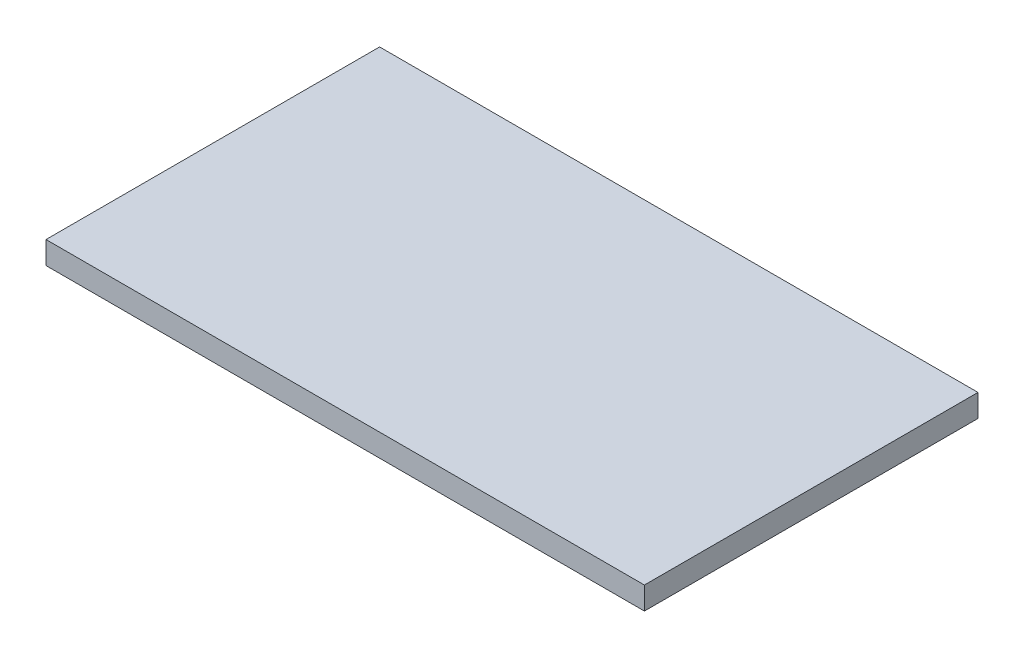
from build123d import *

# Parameters (mm, degrees)
SKETCH1_W           = 148.082
SKETCH1_H           = 82.55
BOSS_EXTRUDE1_DEPTH = 5.588


with BuildPart() as part:
    # Sketch1 → Boss-Extrude1 (new body)
    with BuildSketch(Plane(origin=(0, 0, 0), x_dir=(1, 0, 0), z_dir=(0, 1, 0))):
        Rectangle(SKETCH1_W, SKETCH1_H)
    extrude(amount=BOSS_EXTRUDE1_DEPTH)


solid = part.part
